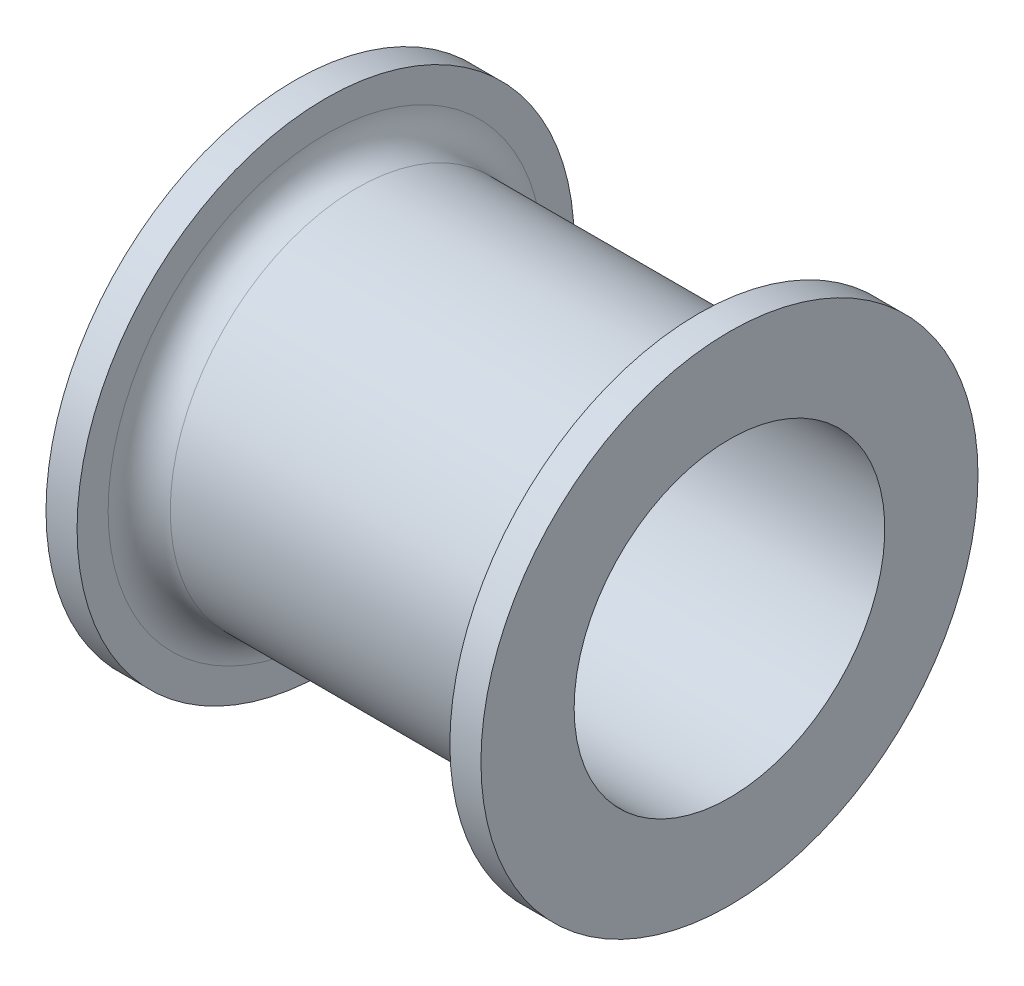
from build123d import *

# Parameters (mm, degrees)
FILLET1_R = 1


with BuildPart() as part:
    # Sketch1 → Revolve1 (revolve)
    with BuildSketch(Plane(origin=(0, 0, 0), x_dir=(1, 0, 0), z_dir=(0, 1, 0)), mode=Mode.PRIVATE) as revolve1_sk:
        Polygon((0, 8), (0, 5), (14, 5), (14, 8), (13, 8), (13, 6), (1, 6), (1, 8), align=None)
    revolve(revolve1_sk.sketch.rotate(Axis((0, 0, 0), (1, 0, 0)), 180), axis=Axis((0, 0, 0), (1, 0, 0)))

    # Fillet1
    fillet1_edges = [part.edges().sort_by_distance(p)[0] for p in [
        (1, 0, -6),
        (13, 0, -6),
    ]]
    fillet(fillet1_edges, radius=FILLET1_R)


solid = part.part
